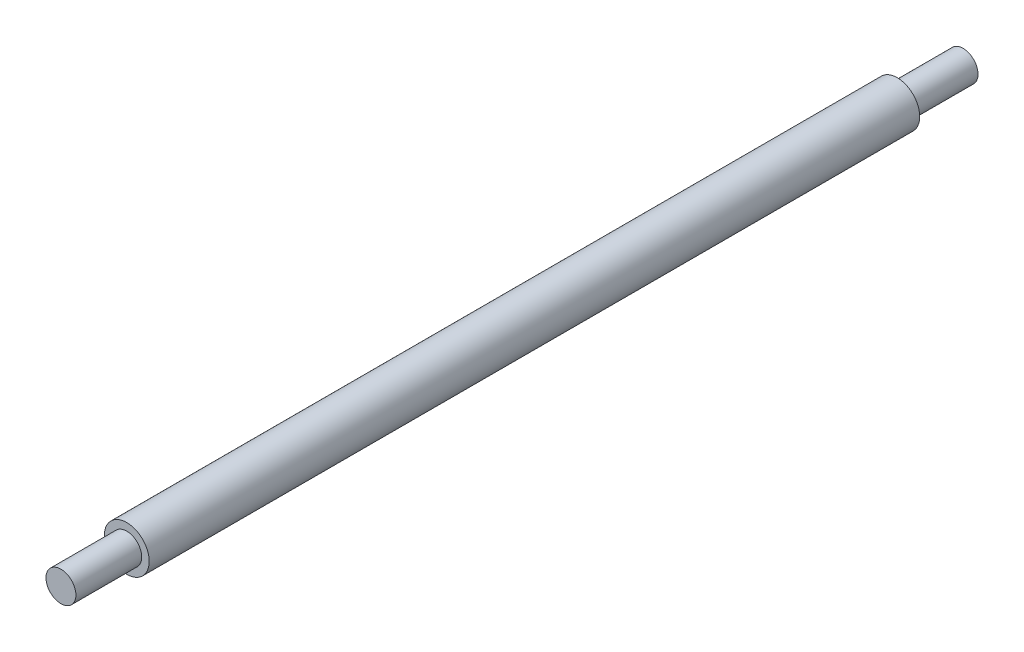
from build123d import *

# Parameters (mm, degrees)
SKETCH1_R           = 9.525
BOSS_EXTRUDE1_DEPTH = 327.025
SKETCH2_R           = 6.35
BOSS_EXTRUDE2_DEPTH = 27.94
BOSS_EXTRUDE3_START = 27.94
SKETCH3_R           = 6.35
BOSS_EXTRUDE3_DEPTH = 27.94


with BuildPart() as part:
    # Sketch1 → Boss-Extrude1 (new body)
    with BuildSketch(Plane.XY):
        with Locations(Location((0, 0, 0), (0, 0, 180))):
            Circle(SKETCH1_R)
    extrude(amount=BOSS_EXTRUDE1_DEPTH)

    # Sketch2 → Boss-Extrude2 (add)
    with BuildSketch(Plane.XY.offset(327.025)):
        Circle(SKETCH2_R)
    extrude(amount=BOSS_EXTRUDE2_DEPTH)

    # Sketch3 → Boss-Extrude3 (add)
    with BuildSketch(Plane(origin=(0, 0, 0), x_dir=(-1, 0, 0), z_dir=(0, 0, -1)).offset(BOSS_EXTRUDE3_START)):
        with Locations(Location((0, 0, 0), (0, 0, 180))):
            Circle(SKETCH3_R)
    extrude(amount=-BOSS_EXTRUDE3_DEPTH)


solid = part.part
